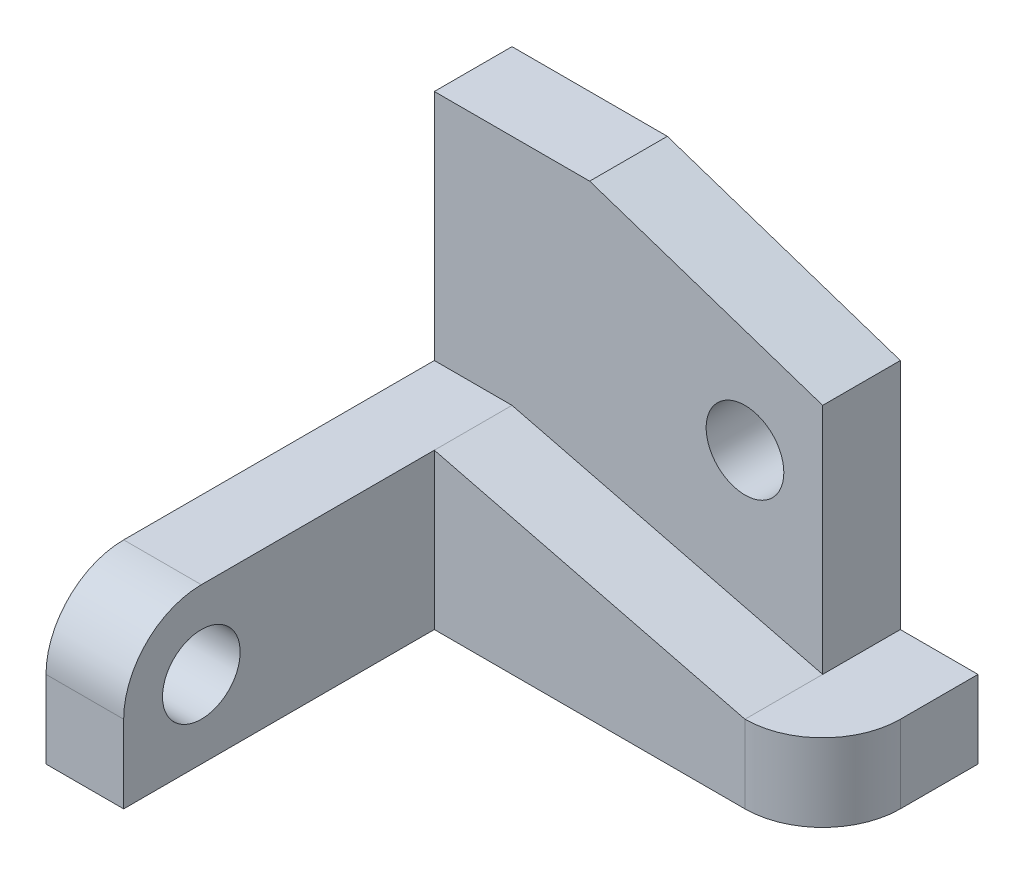
from build123d import *

# Parameters (mm, degrees)
SKETCH2_R           = 5
BOSS_EXTRUDE1_DEPTH = 10
SKETCH4_R           = 5
BOSS_EXTRUDE2_DEPTH = 10
BOSS_EXTRUDE3_DEPTH = 10
SKETCH6_OUTSIDE_W   = 81.698
SKETCH6_OUTSIDE_H   = 81.698
CUT_EXTRUDE1_DEPTH  = 20


with BuildPart() as part:
    # Sketch2 → Boss-Extrude1 (new body)
    with BuildSketch(Plane.XY):
        Polygon((-38.161993769, 22.274143302), (-38.161993769, -27.725856698), (11.838006231, -27.725856698), (11.838006231, 12.274143302), (-18.161993769, 22.274143302), align=None)
        with Locations((1.838006231, 2.274143302)):
            Circle(SKETCH2_R, mode=Mode.SUBTRACT)
    extrude(amount=BOSS_EXTRUDE1_DEPTH)

    # Sketch4 → Boss-Extrude2 (add)
    with BuildSketch(Plane.ZY.offset(38.161993769)):
        with BuildLine():
            Line((10, -7.725856698), (50, -7.725856698))
            ThreePointArc((50, -7.725856698), (57.071067812, -10.654788886), (60, -17.725856698))
            Line((60, -17.725856698), (60, -27.725856698))
            Line((60, -27.725856698), (10, -27.725856698))
            Line((10, -27.725856698), (10, -7.725856698))
        make_face()
        with Locations((50, -17.725856698)):
            Circle(SKETCH4_R, mode=Mode.SUBTRACT)
    extrude(amount=-BOSS_EXTRUDE2_DEPTH)

    # Sketch5 → Boss-Extrude3 (add, symmetric)
    with BuildSketch(Plane.XY.offset(10)):
        Polygon((-28.161993769, -7.725856698), (-28.161993769, -27.725856698), (21.838006231, -27.725856698), (21.838006231, -17.725856698), (11.838006231, -17.725856698), align=None)
    extrude(amount=BOSS_EXTRUDE3_DEPTH, both=True)

    # Sketch6 outside → Cut-Extrude1 (cut)
    with BuildSketch(Plane(origin=(0, -17.725856698, 0), x_dir=(1, 0, 0), z_dir=(0, 1, 0))):
        with Locations((-8.162, -30)):
            Rectangle(SKETCH6_OUTSIDE_W, SKETCH6_OUTSIDE_H)
        with BuildLine():
            Line((21.838006231, 0), (21.838006231, -10))
            ThreePointArc((21.838006231, -10), (18.909074042, -17.071067812), (11.838006231, -20))
            Line((11.838006231, -20), (4.462340435, -20))
            Line((4.462340435, -20), (4.462340435, -63.08469243))
            Line((4.462340435, -63.08469243), (-49.719837023, -63.08469243))
            Line((-49.719837023, -63.08469243), (-49.719837023, 0))
            Line((-49.719837023, 0), (21.838006231, 0))
        make_face(mode=Mode.SUBTRACT)
    extrude(amount=-CUT_EXTRUDE1_DEPTH, mode=Mode.SUBTRACT)


solid = part.part
